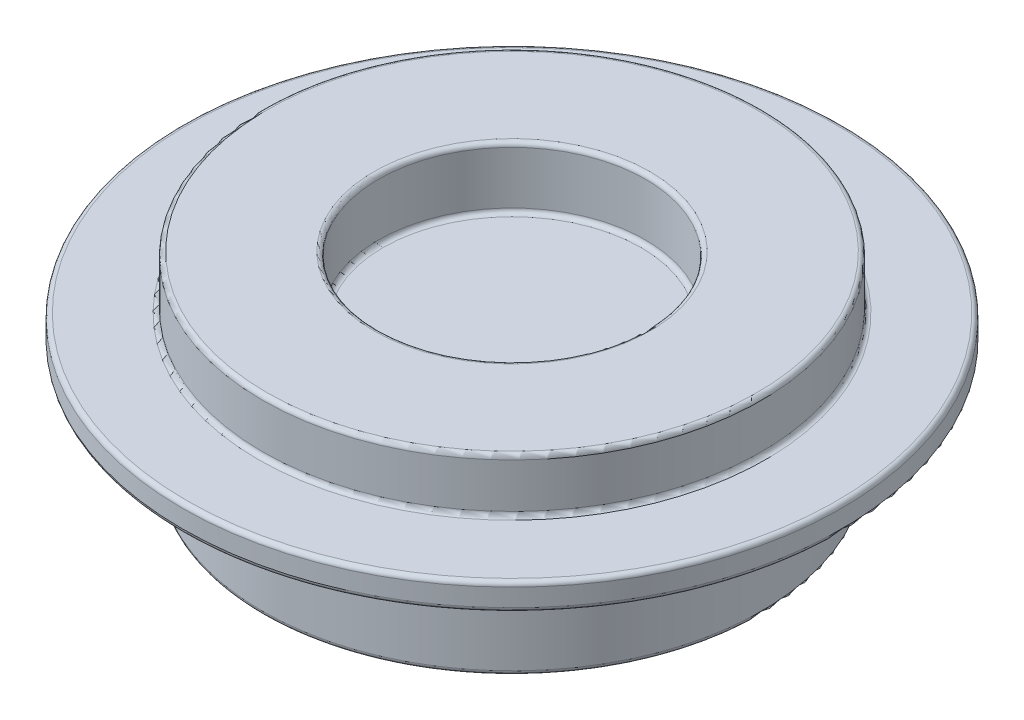
from build123d import *

# Parameters (mm, degrees)
FILLET1_R = 0.25


with BuildPart() as part:
    # Sketch1 → Revolve1 (revolve)
    with BuildSketch(Plane.XY, mode=Mode.PRIVATE) as revolve1_sk:
        Polygon((-14, 4.492665037), (-7.5, 4.492665037), (-7.5, 1.045232274), (0, 1.045232274), (0, -6.257334963), (-14, -6.257334963), (-14, -0.007334963), (-18.5, -0.007334963), (-18.5, 1.492665037), (-14, 1.492665037), align=None)
    revolve(revolve1_sk.sketch.rotate(Axis((0, 8.160146699, 0), (0, -1, 0)), 270), axis=Axis((0, 8.160146699, 0), (0, -1, 0)))

    # Fillet1
    fillet1_edges = [part.edges().sort_by_distance(p)[0] for p in [
        (0, 1.045232274, -7.5),
        (0, 4.492665037, -7.5),
        (0, 4.492665037, -14),
        (0, 1.492665037, -14),
        (0, 1.492665037, -18.5),
        (0, -0.007334963, -18.5),
        (0, -0.007334963, -14),
        (0, -6.257334963, -14),
    ]]
    fillet(fillet1_edges, radius=FILLET1_R)


solid = part.part
